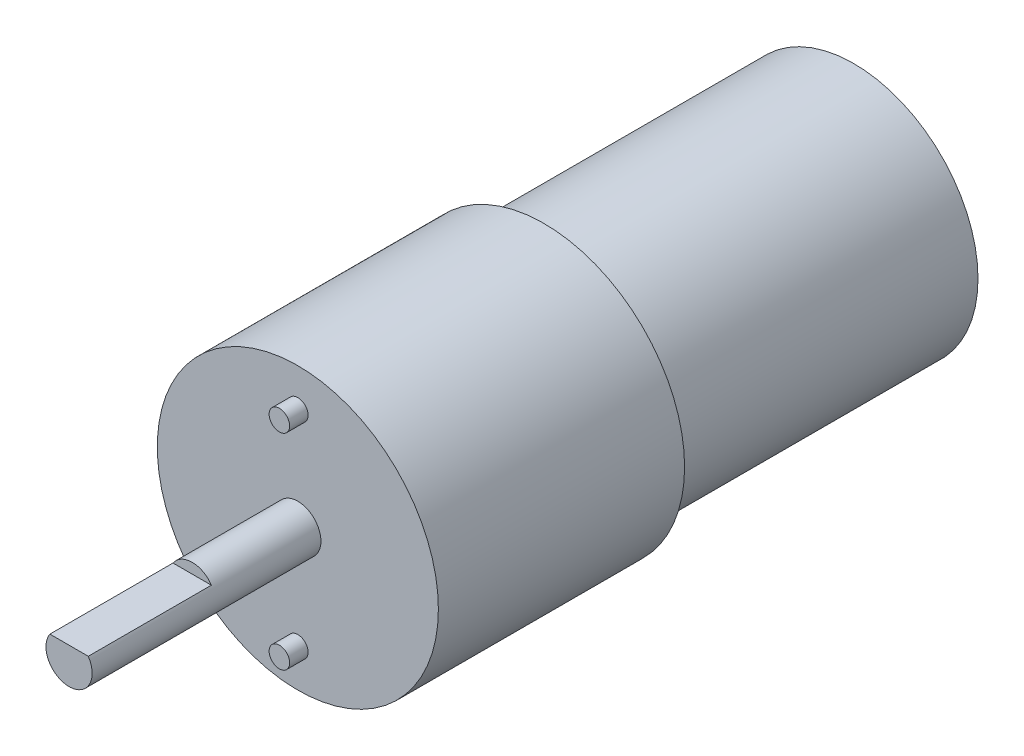
from build123d import *

# Parameters (mm, degrees)
SKETCH1_R           = 12.1
BOSS_EXTRUDE1_DEPTH = 30.2
SKETCH2_R           = 13.7
BOSS_EXTRUDE2_DEPTH = 24
SKETCH4_R           = 1
BOSS_EXTRUDE3_DEPTH = 1.8
SKETCH5_R           = 2.25
BOSS_EXTRUDE4_DEPTH = 22.3
CUT_EXTRUDE1_DEPTH  = 12


with BuildPart() as part:
    # Sketch1 → Boss-Extrude1 (new body)
    with BuildSketch(Plane.XY):
        Circle(SKETCH1_R)
    extrude(amount=BOSS_EXTRUDE1_DEPTH)

    # Sketch2 → Boss-Extrude2 (add)
    with BuildSketch(Plane.XY.offset(30.2)):
        Circle(SKETCH2_R)
    extrude(amount=BOSS_EXTRUDE2_DEPTH)

    # Sketch4 → Boss-Extrude3 (add)
    with BuildSketch(Plane.XY.offset(54.2)):
        with Locations((0, 10)):
            Circle(SKETCH4_R)
        with Locations((0, -10)):
            Circle(SKETCH4_R)
    extrude(amount=BOSS_EXTRUDE3_DEPTH)

    # Sketch5 → Boss-Extrude4 (add)
    with BuildSketch(Plane.XY.offset(54.2)):
        Circle(SKETCH5_R)
    extrude(amount=BOSS_EXTRUDE4_DEPTH)

    # Sketch6 → Cut-Extrude1 (cut)
    with BuildSketch(Plane.XY.offset(76.5)):
        Polygon((-55.042727248, 1.25), (-1.870828693, 1.25), (1.870828693, 1.25), (55.042727248, 1.25), (55.042727248, 107.593797109), (-55.042727248, 107.593797109), align=None)
    extrude(amount=-CUT_EXTRUDE1_DEPTH, mode=Mode.SUBTRACT)


solid = part.part
